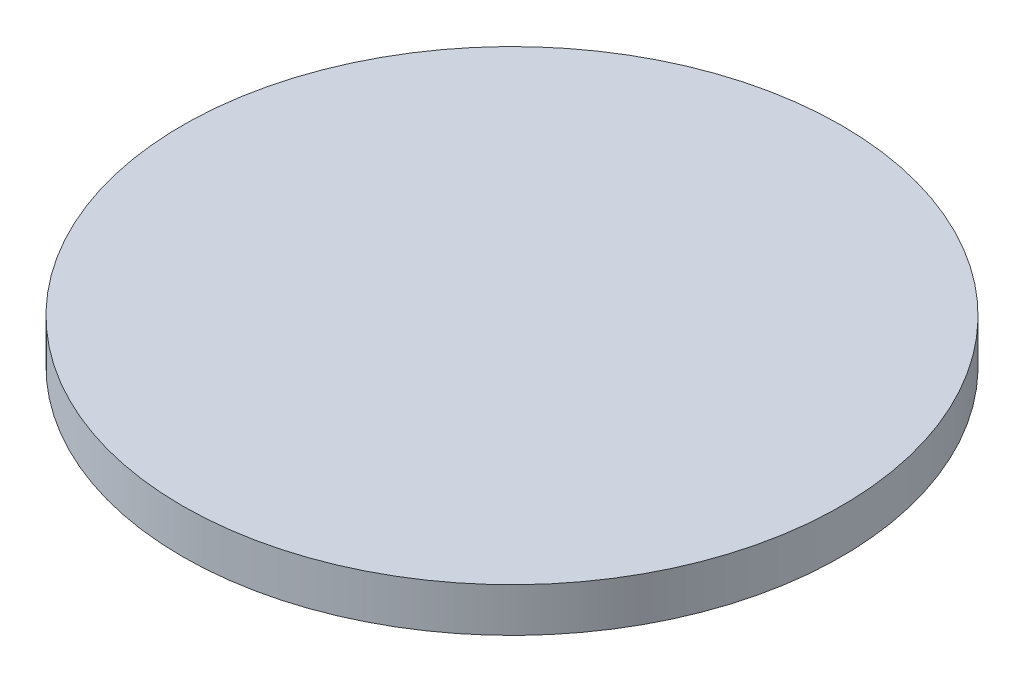
from build123d import *

# Parameters (mm, degrees)
SKETCH_1_R      = 15
EXTRUDE_1_DEPTH = 2


with BuildPart() as part:
    # 草图1 → 凸台-拉伸1 (new body)
    with BuildSketch(Plane(origin=(0, 0, 0), x_dir=(1, 0, 0), z_dir=(0, 1, 0))):
        with Locations(Location((0, 0, 0), (0, 0, 270))):
            Circle(SKETCH_1_R)
    extrude(amount=EXTRUDE_1_DEPTH)


solid = part.part
